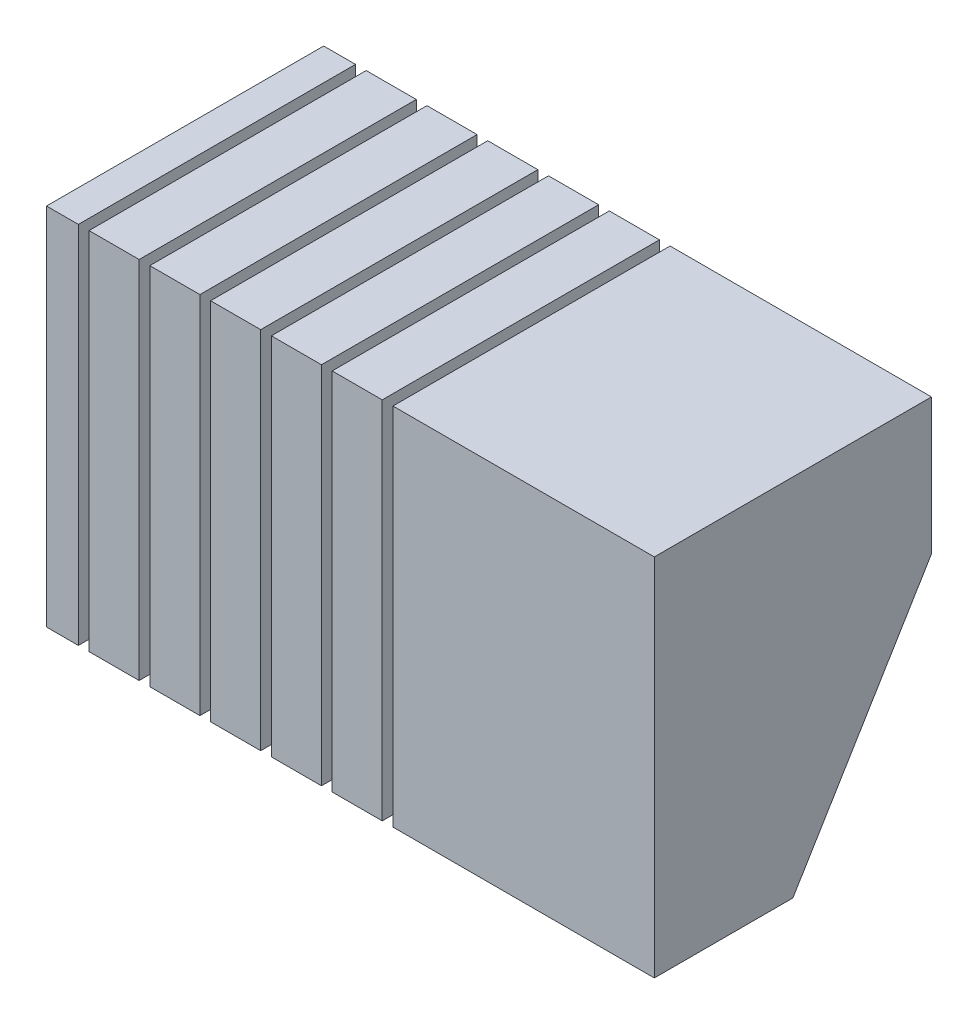
from build123d import *

# Parameters (mm, degrees)
SKETCH1_W           = 250
SKETCH1_H           = 150
BOSS_EXTRUDE1_DEPTH = 114
SKETCH4_W           = 158.825989779
SKETCH4_H           = 169.09880145
CUT_EXTRUDE1_DEPTH  = 114
SKETCH5_W           = 4.398089603
SKETCH5_H           = 146.602986765
CUT_EXTRUDE2_DEPTH  = 227.099535603
LPATTERN1_COUNT     = 6
LPATTERN1_PITCH     = 25


with BuildPart() as part:
    # Sketch1 → Boss-Extrude1 (new body)
    with BuildSketch(Plane.XY):
        Rectangle(SKETCH1_W, SKETCH1_H)
    extrude(amount=BOSS_EXTRUDE1_DEPTH)

    # Sketch4 → Cut-Extrude1 (cut)
    with BuildSketch(Plane(origin=(27.906934923, -24.538252492, -40.49320945), x_dir=(0.8614948455361232, 0.2631519435385569, 0.4342553231988889), z_dir=(-0.5077663154588844, 0.4464731827403718, 0.7367734156299286))):
        with Locations((63.082324951, -59.282681283)):
            Rectangle(SKETCH4_W, SKETCH4_H)
    extrude(amount=-CUT_EXTRUDE1_DEPTH, mode=Mode.SUBTRACT)

    # Sketch5 → Cut-Extrude2 (cut, through all)
    with BuildSketch(Plane.XZ.offset(75)):
        with Locations((-109.711931847, 57.244338312)):
            Rectangle(SKETCH5_W, SKETCH5_H)
    cut_extrude2 = extrude(amount=-CUT_EXTRUDE2_DEPTH, mode=Mode.SUBTRACT)


with BuildPart() as cut_extrude2_piece_1:
    # of the separate pieces the step leaves, piece 1, a body of its own (cut_extrude2_pieces)
    add(part.part.solids().sort_by_distance((-107.512887045, -75, 0))[0])

    # LPattern1: Cut-Extrude2 ×6
    with Locations(*[(i * LPATTERN1_PITCH, 0, 0) for i in range(1, LPATTERN1_COUNT)]):
        add(cut_extrude2, mode=Mode.SUBTRACT)


with BuildPart() as cut_extrude2_piece_2:
    # of the separate pieces the step leaves, piece 2, a body of its own (cut_extrude2_pieces)
    add(part.part.solids().sort_by_distance((-125, -75, 0))[0])


solid = Compound([cut_extrude2_piece_1.part, cut_extrude2_piece_2.part])
